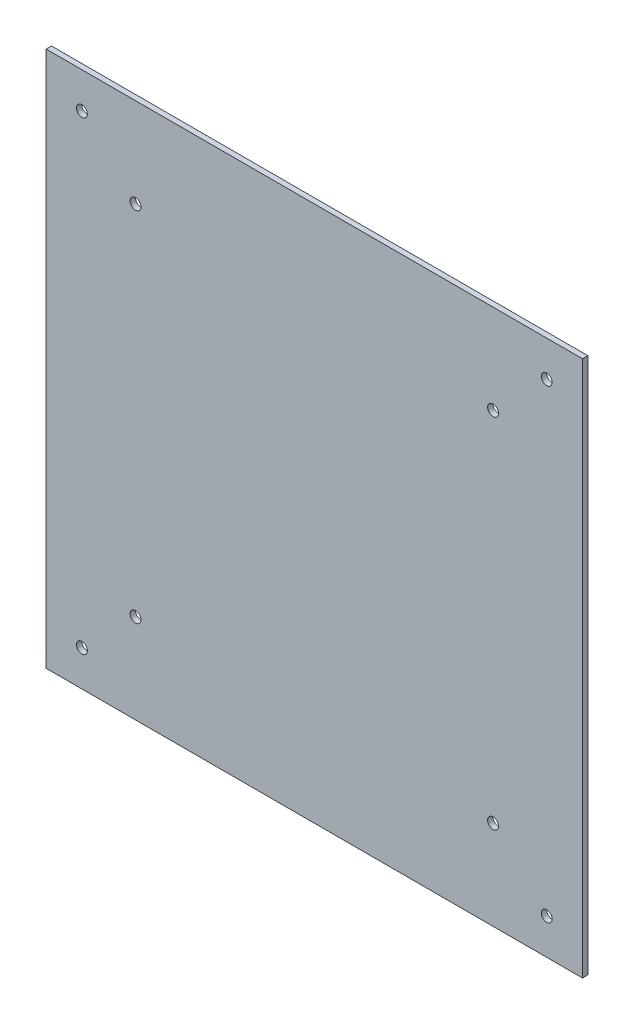
from build123d import *

# Parameters (mm, degrees)
SKETCH1_W                      = 300
SKETCH1_H                      = 300
BOSS_EXTRUDE1_DEPTH            = 3
F_6_1_6_1_DIAMETER_HOLE1_D     = 6.1
F_6_1_6_1_DIAMETER_HOLE1_DEPTH = 23
F_6_1_6_1_DIAMETER_HOLE1_TIP   = 1.832624888


with BuildPart() as part:
    # Sketch1 → Boss-Extrude1 (new body)
    with BuildSketch(Plane.XY):
        Rectangle(SKETCH1_W, SKETCH1_H)
    extrude(amount=BOSS_EXTRUDE1_DEPTH)

    # Ø6.1 (6.1) Diameter Hole1
    with Locations(Plane.XY.offset(3)):
        with Locations((-130, -130), (-100, -100), (130, -130), (100, -100), (130, 130), (-100, 100), (-130, 130), (100, 100)):
            Hole(F_6_1_6_1_DIAMETER_HOLE1_D / 2, depth=F_6_1_6_1_DIAMETER_HOLE1_DEPTH)
            with Locations((0, 0, -(F_6_1_6_1_DIAMETER_HOLE1_DEPTH + F_6_1_6_1_DIAMETER_HOLE1_TIP / 2))):  # 118° drill point
                Cone(0, F_6_1_6_1_DIAMETER_HOLE1_D / 2, F_6_1_6_1_DIAMETER_HOLE1_TIP, mode=Mode.SUBTRACT)


solid = part.part
